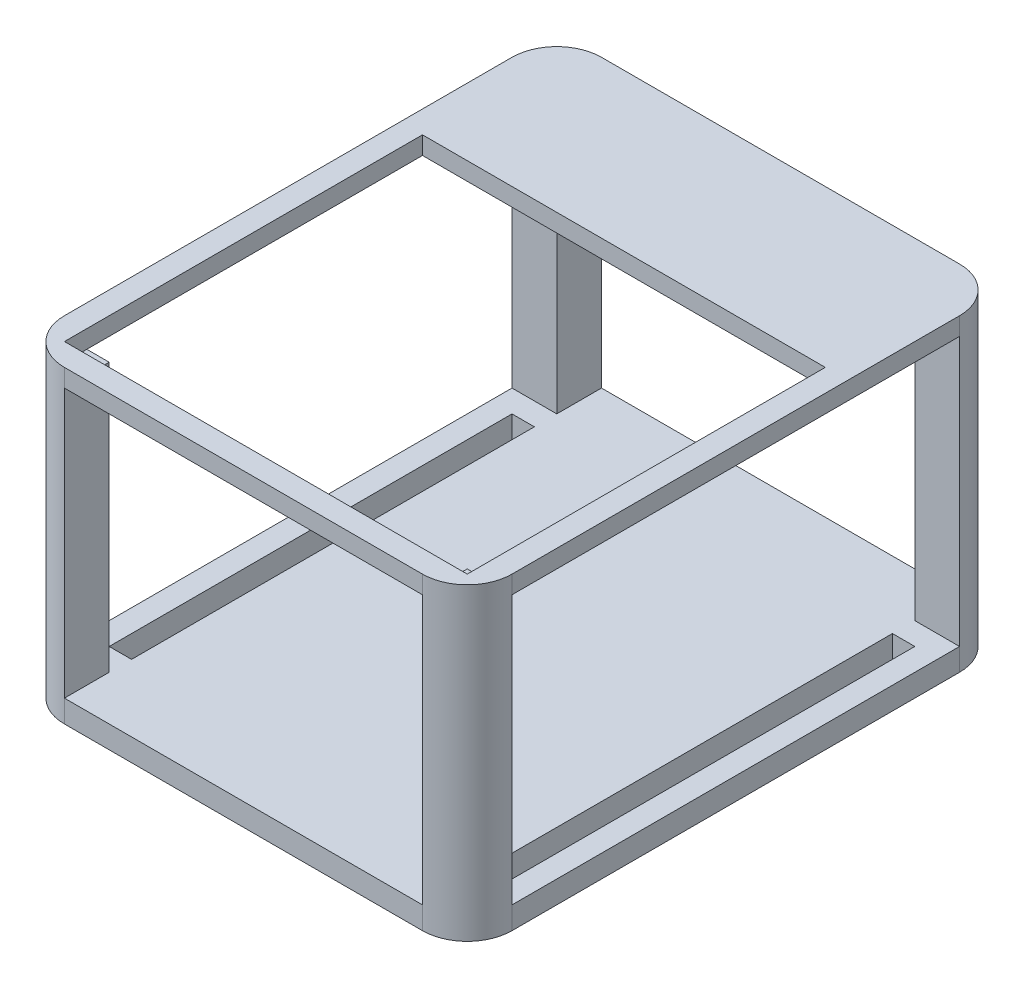
from build123d import *

# Parameters (mm, degrees)
BOSS_EXTRUDE1_DEPTH = 5
SKETCH2_W           = 5
SKETCH2_H           = 90
CUT_EXTRUDE1_DEPTH  = 79.262379212
BOSS_EXTRUDE3_DEPTH = 60
BOSS_EXTRUDE4_DEPTH = 4
SKETCH5_W           = 90
SKETCH5_H           = 80
CUT_EXTRUDE2_DEPTH  = 4


with BuildPart() as part:
    # Sketch1 → Boss-Extrude1 (new body)
    with BuildSketch(Plane(origin=(0, 0, 0), x_dir=(1, 0, 0), z_dir=(0, 1, 0))):
        with BuildLine():
            Line((-40, 60), (40, 60))
            ThreePointArc((40, 60), (47.071067812, 57.071067812), (50, 50))
            Line((50, 50), (50, -50))
            ThreePointArc((50, -50), (47.071067812, -57.071067812), (40, -60))
            Line((40, -60), (-40, -60))
            ThreePointArc((-40, -60), (-47.071067812, -57.071067812), (-50, -50))
            Line((-50, -50), (-50, 50))
            ThreePointArc((-50, 50), (-47.071067812, 57.071067812), (-40, 60))
        make_face()
    extrude(amount=BOSS_EXTRUDE1_DEPTH)

    # Sketch2 → Cut-Extrude1 (cut, through all)
    with BuildSketch(Plane(origin=(0, 5, 0), x_dir=(1, 0, 0), z_dir=(0, 1, 0))):
        with Locations((-42.5, 0)):
            Rectangle(SKETCH2_W, SKETCH2_H)
        with Locations((42.5, 0)):
            Rectangle(SKETCH2_W, SKETCH2_H)
    extrude(amount=-CUT_EXTRUDE1_DEPTH, mode=Mode.SUBTRACT)

    # Sketch3 → Boss-Extrude3 (add)
    with BuildSketch(Plane(origin=(0, 5, 0), x_dir=(1, 0, 0), z_dir=(0, 1, 0))):
        with BuildLine():
            Line((-50, 50), (-40, 50))
            Line((-40, 50), (-40, 60))
            ThreePointArc((-40, 60), (-47.071067812, 57.071067812), (-50, 50))
        make_face()
        with BuildLine():
            Line((40, 60), (40, 50))
            Line((40, 50), (50, 50))
            ThreePointArc((50, 50), (47.071067812, 57.071067812), (40, 60))
        make_face()
        with BuildLine():
            Line((-50, -50), (-40, -50))
            Line((-40, -50), (-40, -60))
            ThreePointArc((-40, -60), (-47.071067812, -57.071067812), (-50, -50))
        make_face()
        with BuildLine():
            Line((50, -50), (40, -50))
            Line((40, -50), (40, -60))
            ThreePointArc((40, -60), (47.071067812, -57.071067812), (50, -50))
        make_face()
    extrude(amount=BOSS_EXTRUDE3_DEPTH)

    # Sketch4 → Boss-Extrude4 (add)
    with BuildSketch(Plane(origin=(0, 65, 0), x_dir=(1, 0, 0), z_dir=(0, 1, 0))):
        with BuildLine():
            Line((50, -50), (50, 50))
            ThreePointArc((50, 50), (47.071067812, 57.071067812), (40, 60))
            Line((40, 60), (-40, 60))
            ThreePointArc((-40, 60), (-47.071067812, 57.071067812), (-50, 50))
            Line((-50, 50), (-50, -50))
            ThreePointArc((-50, -50), (-47.071067812, -57.071067812), (-40, -60))
            Line((-40, -60), (40, -60))
            ThreePointArc((40, -60), (47.071067812, -57.071067812), (50, -50))
        make_face()
    extrude(amount=BOSS_EXTRUDE4_DEPTH)

    # Sketch5 → Cut-Extrude2 (cut)
    with BuildSketch(Plane(origin=(0, 69, 0), x_dir=(1, 0, 0), z_dir=(0, 1, 0))):
        with Locations((0, -15)):
            Rectangle(SKETCH5_W, SKETCH5_H)
    extrude(amount=-CUT_EXTRUDE2_DEPTH, mode=Mode.SUBTRACT)


solid = part.part
